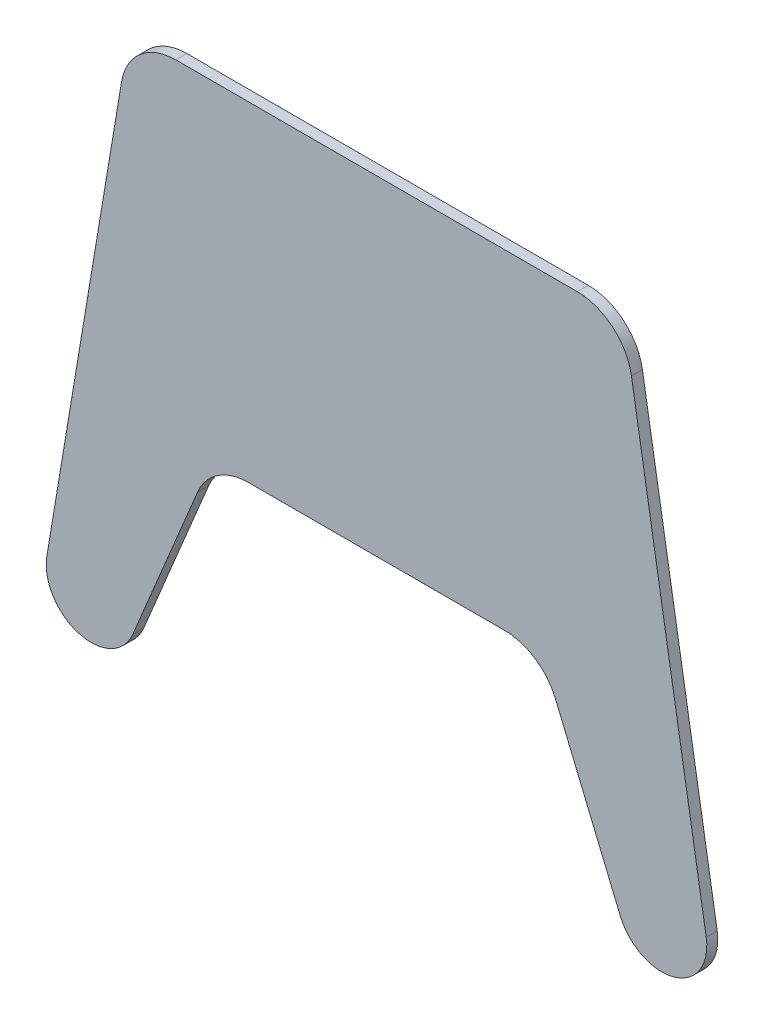
from build123d import *

# Parameters (mm, degrees)
BOSS_EXTRUDE1_DEPTH = 2.54


with BuildPart() as part:
    # Sketch1 → Boss-Extrude1 (new body)
    with BuildSketch(Plane.XY):
        with BuildLine():
            Line((-58.91868881, 27.487867139), (-76.2, -76.2))
            ThreePointArc((-76.2, -76.2), (-68.819471722, -87.89820202), (-56.352718657, -81.906524778))
            Line((-56.352718657, -81.906524778), (-53.975, -76.2))
            Line((-53.975, -76.2), (-41.356410256, -45.915384615))
            ThreePointArc((-41.356410256, -45.915384615), (-36.678025825, -40.232961262), (-29.633333333, -38.1))
            Line((-29.633333333, -38.1), (29.633333333, -38.1))
            ThreePointArc((29.633333333, -38.1), (36.678025825, -40.232961262), (41.356410256, -45.915384615))
            Line((41.356410256, -45.915384615), (53.975, -76.2))
            Line((53.975, -76.2), (56.352718657, -81.906524778))
            ThreePointArc((56.352718657, -81.906524778), (68.819471722, -87.89820202), (76.2, -76.2))
            Line((76.2, -76.2), (58.91868881, 27.487867139))
            ThreePointArc((58.91868881, 27.487867139), (54.600447158, 35.090353777), (46.391485978, 38.1))
            Line((46.391485978, 38.1), (-46.391485978, 38.1))
            ThreePointArc((-46.391485978, 38.1), (-54.600447158, 35.090353777), (-58.91868881, 27.487867139))
        make_face()
    extrude(amount=BOSS_EXTRUDE1_DEPTH)


solid = part.part
